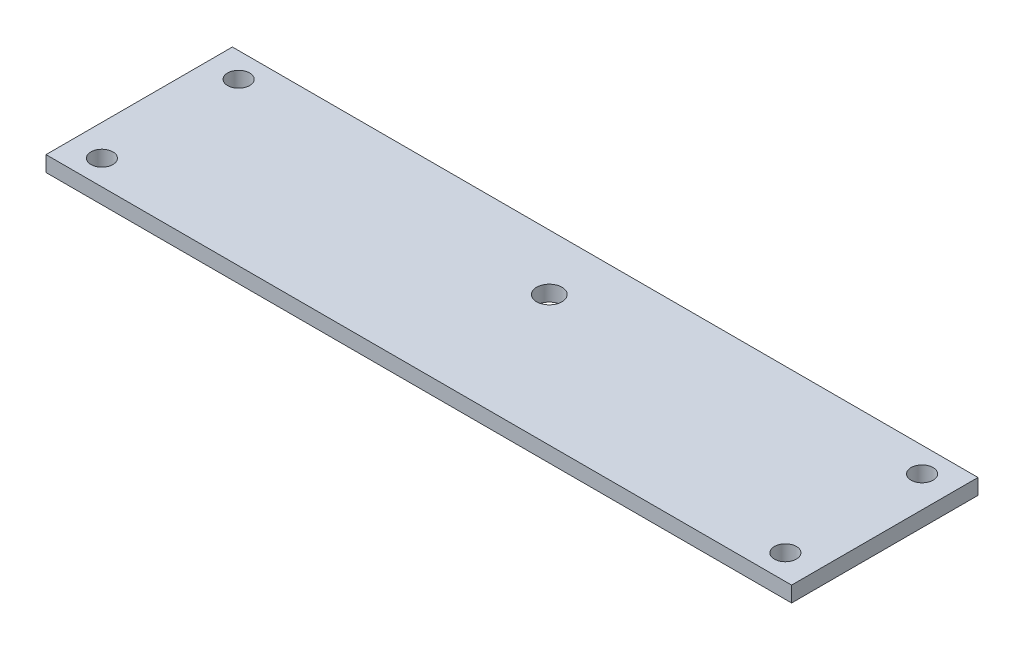
from build123d import *

# Parameters (mm, degrees)
BOSS_EXTRUDE1_DEPTH        = 19.05
BOSS_EXTRUDE1_DEPTH_BACK   = 19.05
SKETCH3_W                  = 152.4
SKETCH3_H                  = 3.175
F_8_CLEARANCE_HOLE1_D      = 4.4958
F_6_0_204_DIAMETER_HOLE1_D = 5.1816


with BuildPart() as part:
    # Sketch3 → Boss-Extrude1 (new, two sides: drawn at the far end of the back side and taken through both)
    with BuildSketch(Plane.XY.offset(-BOSS_EXTRUDE1_DEPTH_BACK)):
        Rectangle(SKETCH3_W, SKETCH3_H)
    extrude(amount=BOSS_EXTRUDE1_DEPTH + BOSS_EXTRUDE1_DEPTH_BACK)

    # #8 Clearance Hole1 (through all)
    with Locations(Plane(origin=(0, 1.5875, 0), x_dir=(1, 0, 0), z_dir=(0, 1, 0))):
        with Locations((-69.85, 13.97), (-69.85, -13.97)):
            f_8_clearance_hole1 = Hole(F_8_CLEARANCE_HOLE1_D / 2)

    # Mirror1: #8 Clearance Hole1 across plane
    add(f_8_clearance_hole1.mirror(Plane(origin=(0, 0, 0), x_dir=(0, 0, 1), z_dir=(1, 0, 0))), mode=Mode.SUBTRACT)

    # #6 (0.204) Diameter Hole1 (through all)
    with Locations(Plane(origin=(0, 1.5875, 0), x_dir=(1, 0, 0), z_dir=(0, 1, 0))):
        with Locations((0, 7.62)):
            Hole(F_6_0_204_DIAMETER_HOLE1_D / 2)


solid = part.part
